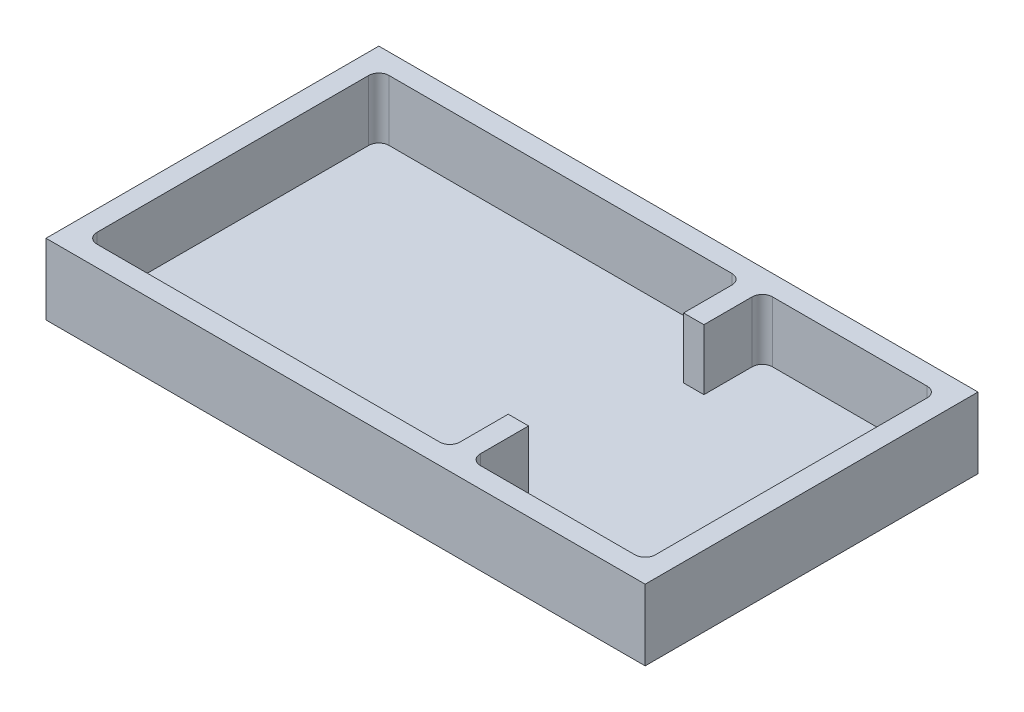
from build123d import *

# Parameters (mm, degrees)
SKETCH11_W     = 187.05178758
SKETCH11_H     = 103.91050065
EXTRUDE5_DEPTH = 18.923
SKETCH14_W     = 187.05178758
SKETCH14_H     = 103.91050065
EXTRUDE6_DEPTH = 3.175


with BuildPart() as part:
    # Sketch11 → Extrude5 (new body)
    with BuildSketch(Plane(origin=(0, 0, 0), x_dir=(1, 0, 0), z_dir=(0, 1, 0))):
        with Locations((93.52589379, 51.955250325)):
            Rectangle(SKETCH11_W, SKETCH11_H)
        with BuildLine():
            Line((9.525, 6.35), (116.541319734, 6.35))
            ThreePointArc((116.541319734, 6.35), (118.786383764, 7.27993597), (119.716319734, 9.525))
            Line((119.716319734, 9.525), (119.716319734, 24.585352544))
            Line((119.716319734, 24.585352544), (126.066319734, 24.585352544))
            Line((126.066319734, 24.585352544), (126.066319734, 9.525))
            ThreePointArc((126.066319734, 9.525), (126.996255703, 7.27993597), (129.241319734, 6.35))
            Line((129.241319734, 6.35), (177.52678758, 6.35))
            ThreePointArc((177.52678758, 6.35), (179.77185161, 7.27993597), (180.70178758, 9.525))
            Line((180.70178758, 9.525), (180.70178758, 94.38550065))
            ThreePointArc((180.70178758, 94.38550065), (179.77185161, 96.63056468), (177.52678758, 97.56050065))
            Line((177.52678758, 97.56050065), (129.241319734, 97.56050065))
            ThreePointArc((129.241319734, 97.56050065), (126.996255703, 96.63056468), (126.066319734, 94.38550065))
            Line((126.066319734, 94.38550065), (126.066319734, 79.325148105))
            Line((126.066319734, 79.325148105), (119.716319734, 79.325148105))
            Line((119.716319734, 79.325148105), (119.716319734, 94.38550065))
            ThreePointArc((119.716319734, 94.38550065), (118.786383764, 96.63056468), (116.541319734, 97.56050065))
            Line((116.541319734, 97.56050065), (9.525, 97.56050065))
            ThreePointArc((9.525, 97.56050065), (7.27993597, 96.63056468), (6.35, 94.38550065))
            Line((6.35, 94.38550065), (6.35, 9.525))
            ThreePointArc((6.35, 9.525), (7.27993597, 7.27993597), (9.525, 6.35))
        make_face(mode=Mode.SUBTRACT)
    extrude(amount=EXTRUDE5_DEPTH)

    # Sketch14 → Extrude6 (add)
    with BuildSketch(Plane(origin=(0, 0, 0), x_dir=(1, 0, 0), z_dir=(0, 1, 0))):
        with Locations((93.52589379, 51.955250325)):
            Rectangle(SKETCH14_W, SKETCH14_H)
    extrude(amount=-EXTRUDE6_DEPTH)


solid = part.part
